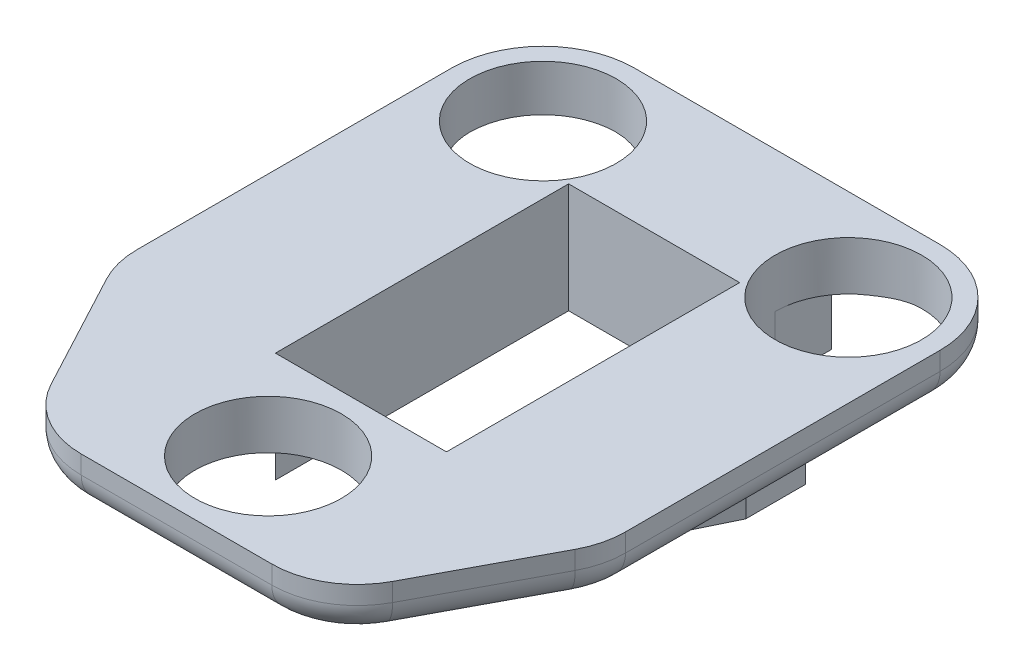
from build123d import *
from build123d.topology import SkipClean

# Parameters (mm, degrees)
BOSS_EXTRUDE1_DEPTH = 40
FILLET1_R           = 25
SKETCH3_R           = 60
SKETCH3_W           = 140
SKETCH3_H           = 240
CUT_EXTRUDE1_DEPTH  = 360.436212163
BOSS_EXTRUDE2_START = 50
BOSS_EXTRUDE2_DEPTH = 50


with BuildPart() as part:
    # Sketch2 → Boss-Extrude1 (new body)
    with BuildSketch(Plane.XZ.offset(-202.963495408)):
        with BuildLine():
            Line((-139.764705882, 258.904671879), (-191.764705882, 161.404671879))
            ThreePointArc((-191.764705882, 161.404671879), (-197.90997501, 145.440989161), (-200, 128.463495408))
            Line((-200, 128.463495408), (-200, -129.036504592))
            ThreePointArc((-200, -129.036504592), (-178.033008589, -182.06951318), (-125, -204.036504592))
            Line((-125, -204.036504592), (125, -204.036504592))
            ThreePointArc((125, -204.036504592), (178.033008589, -182.06951318), (200, -129.036504592))
            Line((200, -129.036504592), (200, 128.463495408))
            ThreePointArc((200, 128.463495408), (197.90997501, 145.440989161), (191.764705882, 161.404671879))
            Line((191.764705882, 161.404671879), (139.764705882, 258.904671879))
            ThreePointArc((139.764705882, 258.904671879), (114.01470288, 285.988000208), (78, 295.963495408))
            Line((78, 295.963495408), (-78, 295.963495408))
            ThreePointArc((-78, 295.963495408), (-114.01470288, 285.988000208), (-139.764705882, 258.904671879))
        make_face()
    extrude(amount=BOSS_EXTRUDE1_DEPTH)

    # Fillet1
    fillet1_edges = [part.edges().sort_by_distance(p)[0] for p in [
        (-197.90997501, 162.963495408, 145.440989161),
        (-200, 162.963495408, -0.286504592),
        (-178.033008589, 162.963495408, -182.06951318),
        (0, 162.963495408, -204.036504592),
        (178.033008589, 162.963495408, -182.06951318),
        (200, 162.963495408, -0.286504592),
        (197.90997501, 162.963495408, 145.440989161),
        (165.764705882, 162.963495408, 210.154671879),
        (114.01470288, 162.963495408, 285.988000208),
        (0, 162.963495408, 295.963495408),
        (-114.01470288, 162.963495408, 285.988000208),
        (-165.764705882, 162.963495408, 210.154671879),
    ]]
    fillet(fillet1_edges, radius=FILLET1_R)

    # Sketch3 → Cut-Extrude1 (cut, through all)
    with BuildSketch(Plane.XZ.offset(-162.963495408)):
        with Locations(Location((0, 221, 0), (0, 0, 270))):
            Circle(SKETCH3_R)
        with Locations(Location((125, -129, 0), (0, 0, 270))):
            Circle(SKETCH3_R)
        with Locations(Location((-125, -129, 0), (0, 0, 270))):
            Circle(SKETCH3_R)
        with Locations((0, 25)):
            Rectangle(SKETCH3_W, SKETCH3_H)
    extrude(amount=-CUT_EXTRUDE1_DEPTH, mode=Mode.SUBTRACT)

    # Sketch4 → Boss-Extrude2 (add)
    with SkipClean():  # the faces are left unmerged after this step: merging them gives an invalid solid
        with BuildSketch(Plane.XZ.offset(-162.963495408).offset(BOSS_EXTRUDE2_START)):
            with BuildLine():
                Line((-70, 145), (-150, -20))
                Line((-150, -20), (-150, -69))
                Line((-150, -69), (-125, -69))
                ThreePointArc((-125, -69), (-82.573593129, -86.573593129), (-65, -129))
                Line((-65, -129), (-65, -175))
                Line((-65, -175), (65, -175))
                Line((65, -175), (65, -129))
                ThreePointArc((65, -129), (82.573593129, -86.573593129), (125, -69))
                Line((125, -69), (150, -69))
                Line((150, -69), (150, -20))
                Line((150, -20), (70, 145))
                Line((70, 145), (70, -95))
                Line((70, -95), (-70, -95))
                Line((-70, -95), (-70, 145))
            make_face()
        extrude(amount=-BOSS_EXTRUDE2_DEPTH)


solid = part.part
